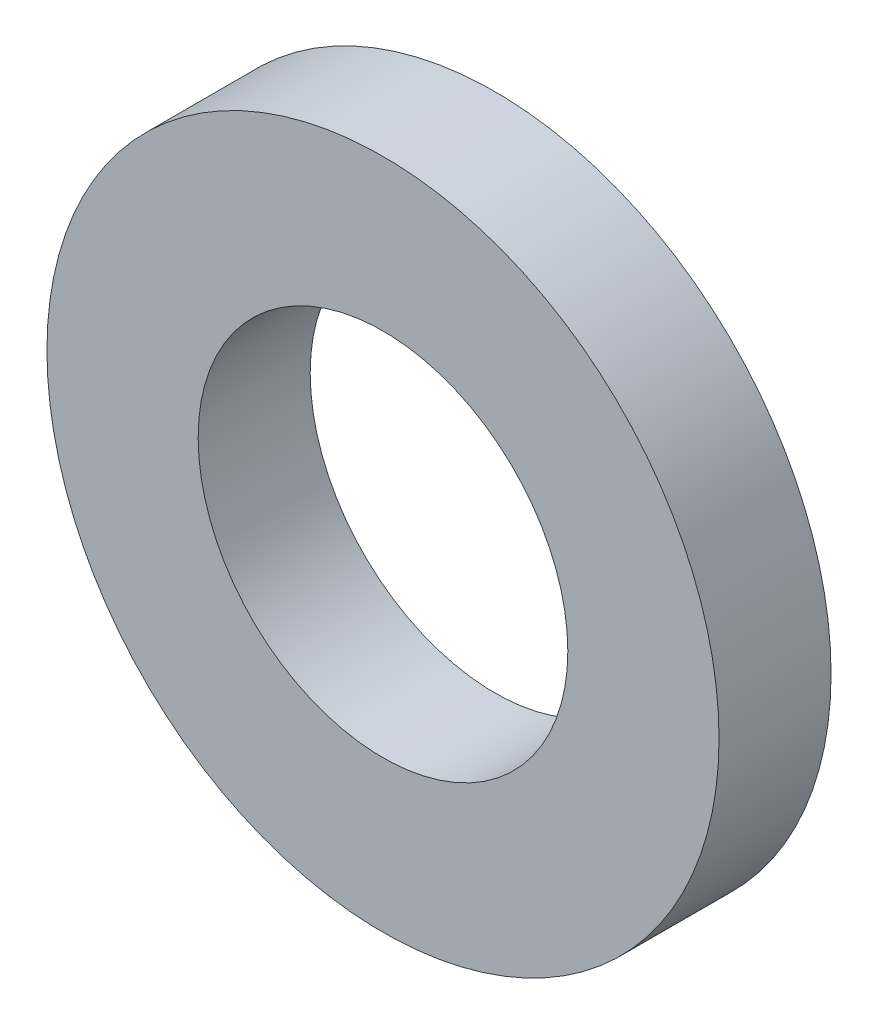
from build123d import *

# Parameters (mm, degrees)
SKETCH_1_R        = 3
SKETCH_1_R_2      = 1.65
EXTRUDE_205_DEPTH = 1


with BuildPart() as part:
    # 草图1 → Extrude 205 (new body)
    with BuildSketch(Plane.XY):
        Circle(SKETCH_1_R)
        Circle(SKETCH_1_R_2, mode=Mode.SUBTRACT)
    extrude(amount=EXTRUDE_205_DEPTH)


solid = part.part
